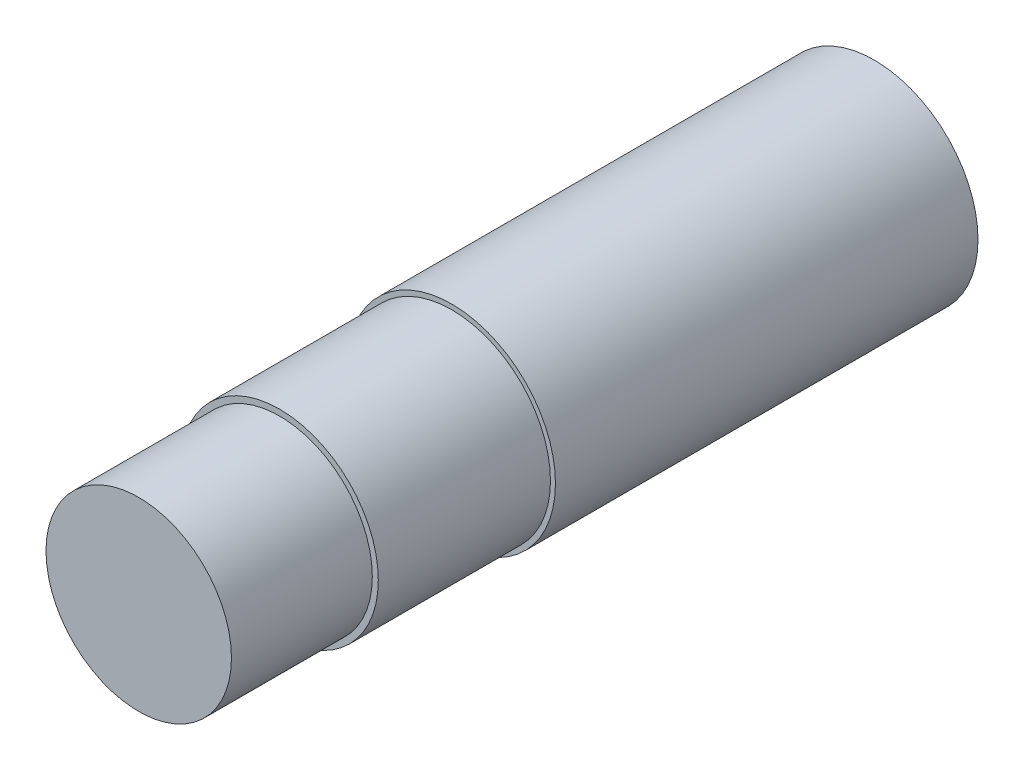
from build123d import *

# Parameters (mm, degrees)
SKETCH1_R           = 6.625
BOSS_EXTRUDE1_DEPTH = 27
SKETCH1_3_R         = 6.307204498
BOSS_EXTRUDE2_DEPTH = 38
SKETCH2_R           = 5.925018159
BOSS_EXTRUDE3_DEPTH = 9


with BuildPart() as part:
    # Sketch1 → Boss-Extrude1 (new body)
    with BuildSketch(Plane.XY):
        Circle(SKETCH1_R)
    extrude(amount=BOSS_EXTRUDE1_DEPTH)

    # Sketch1<3> → Boss-Extrude2 (add)
    with BuildSketch(Plane.XY):
        Circle(SKETCH1_3_R)
    extrude(amount=BOSS_EXTRUDE2_DEPTH)

    # Sketch2 → Boss-Extrude3 (add)
    with BuildSketch(Plane.XY.offset(38)):
        Circle(SKETCH2_R)
    extrude(amount=BOSS_EXTRUDE3_DEPTH)


solid = part.part
